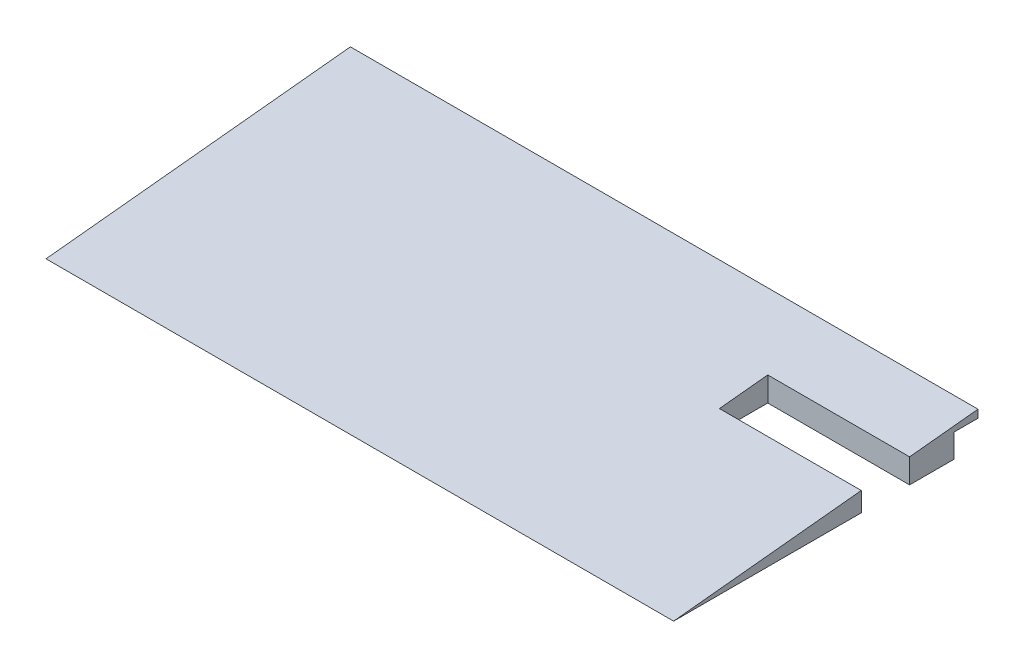
from build123d import *

# Parameters (mm, degrees)
BOSS_EXTRUDE1_DEPTH = 100
SKETCH3_W           = 7.7
SKETCH3_H           = 7.5
CUT_EXTRUDE1_DEPTH  = 207.039437972
SKETCH6_W           = 45.2
SKETCH6_H           = 15.4
CUT_EXTRUDE2_DEPTH  = 112.589650058


with BuildPart() as part:
    # Sketch1 → Boss-Extrude1 (new, symmetric)
    with BuildSketch(Plane(origin=(0, 0, 0), x_dir=(0, 0, -1), z_dir=(1, 0, 0))):
        Polygon((-48.5, 0), (48.5, 10), (48.5, 0), align=None)
    extrude(amount=BOSS_EXTRUDE1_DEPTH, both=True)

    # Sketch3 → Cut-Extrude1 (cut, through all)
    with BuildSketch(Plane(origin=(100, 0, 0), x_dir=(0, 0, -1), z_dir=(1, 0, 0))):
        with Locations((44.65, 3.75)):
            Rectangle(SKETCH3_W, SKETCH3_H)
    extrude(amount=-CUT_EXTRUDE1_DEPTH, mode=Mode.SUBTRACT)

    # Sketch6 → Cut-Extrude2 (cut, through all)
    with BuildSketch(Plane(origin=(0, 0, 0), x_dir=(1, 0, 0), z_dir=(0, 1, 0))):
        with Locations((77.4, 19)):
            Rectangle(SKETCH6_W, SKETCH6_H)
    extrude(amount=CUT_EXTRUDE2_DEPTH, mode=Mode.SUBTRACT)


solid = part.part
